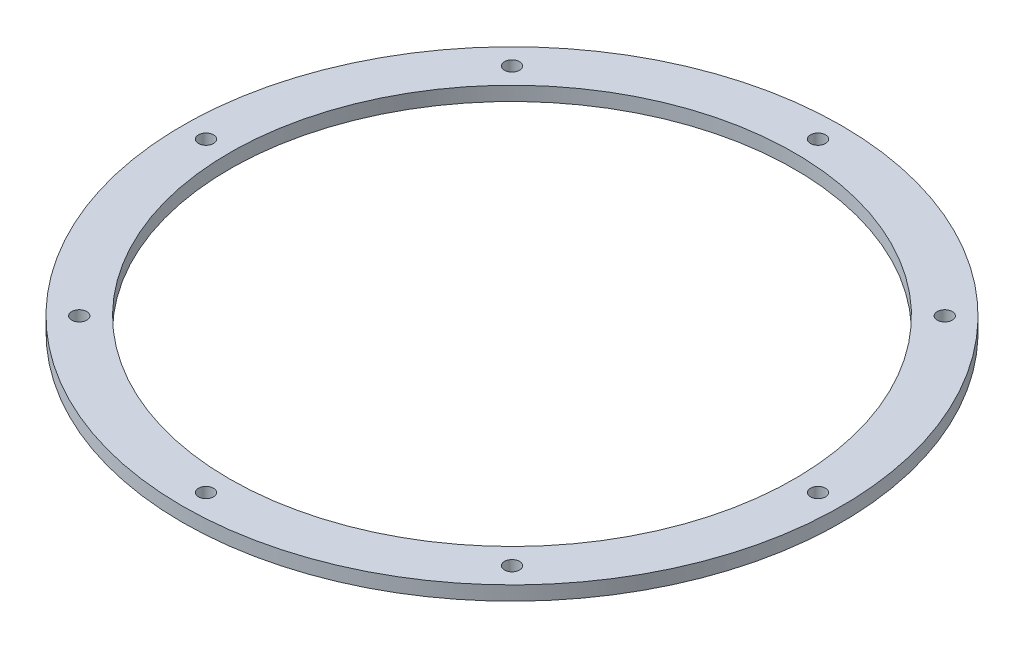
from build123d import *

# Parameters (mm, degrees)
SKETCH1_R           = 70
SKETCH1_R_2         = 60
SKETCH1_R_3         = 1.6
BOSS_EXTRUDE1_DEPTH = 3


with BuildPart() as part:
    # Sketch1 → Boss-Extrude1 (new body)
    with BuildSketch(Plane(origin=(0, 0, 0), x_dir=(1, 0, 0), z_dir=(0, 1, 0))):
        with Locations(Location((0, 0, 0), (0, 0, 270))):
            Circle(SKETCH1_R)
        with Locations(Location((0, 0, 0), (0, 0, 270))):
            Circle(SKETCH1_R_2, mode=Mode.SUBTRACT)
        with Locations(Location((0, 65, 0), (0, 0, 270))):
            Circle(SKETCH1_R_3, mode=Mode.SUBTRACT)
        with Locations(Location((45.961940777, 45.961940777, 0), (0, 0, 270))):
            Circle(SKETCH1_R_3, mode=Mode.SUBTRACT)
        with Locations(Location((65, 0, 0), (0, 0, 270))):
            Circle(SKETCH1_R_3, mode=Mode.SUBTRACT)
        with Locations(Location((45.961940777, -45.961940777, 0), (0, 0, 270))):
            Circle(SKETCH1_R_3, mode=Mode.SUBTRACT)
        with Locations(Location((0, -65, 0), (0, 0, 270))):
            Circle(SKETCH1_R_3, mode=Mode.SUBTRACT)
        with Locations(Location((-45.961940777, -45.961940777, 0), (0, 0, 270))):
            Circle(SKETCH1_R_3, mode=Mode.SUBTRACT)
        with Locations(Location((-65, 0, 0), (0, 0, 270))):
            Circle(SKETCH1_R_3, mode=Mode.SUBTRACT)
        with Locations(Location((-45.961940777, 45.961940777, 0), (0, 0, 270))):
            Circle(SKETCH1_R_3, mode=Mode.SUBTRACT)
    extrude(amount=BOSS_EXTRUDE1_DEPTH)


solid = part.part
